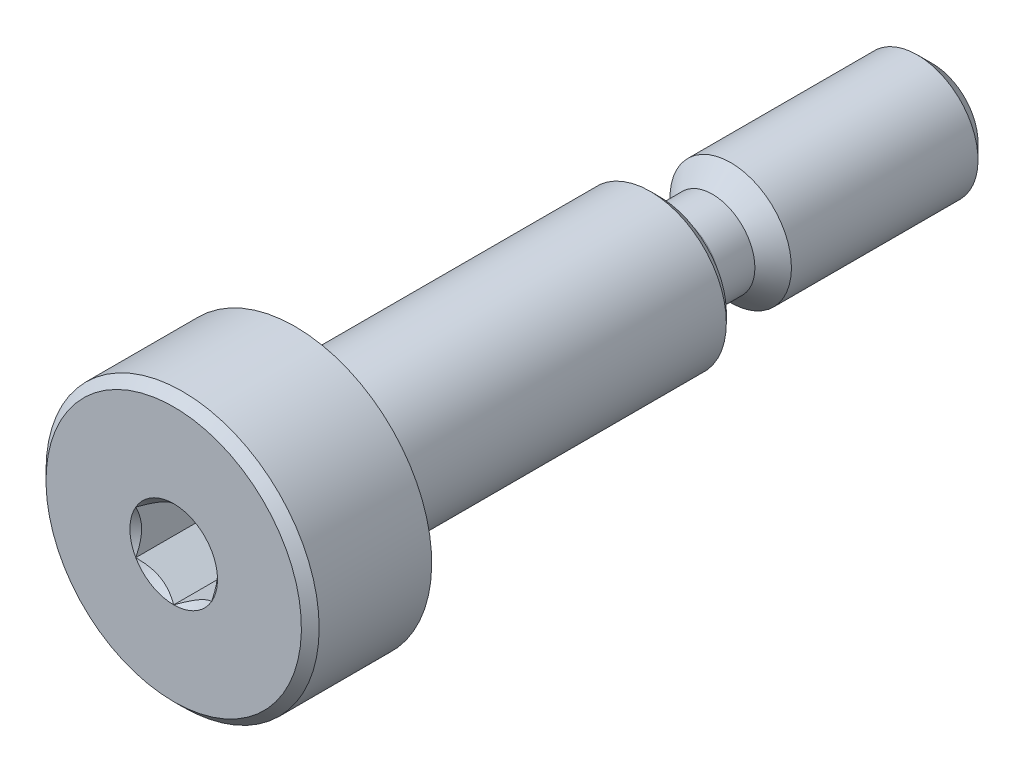
from build123d import *

# Parameters (mm, degrees)
SKETCH12_W         = 0.6
SKETCH12_H         = 0.6
CHAMFER3_SIZE      = 0.1625
CHAMFER1_SIZE      = 0.5
CHAMFER2_SIZE      = 0.2925
CUT_EXTRUDE2_DEPTH = 2


with BuildPart() as part:
    # Sketch1 → Revolve1 (revolve)
    with BuildSketch(Plane(origin=(0, 0, 0), x_dir=(0, 0, -1), z_dir=(1, 0, 0))):
        Polygon((0, 4.5), (4, 4.5), (4, 2.5), (16, 2.5), (16, 2), (25, 2), (25, 0), (0, 0), align=None)
    revolve(axis=Axis((0, 0, -25), (0, 0, 1)))

    # Sketch12 → Cut-Revolve2 (revolve, cut)
    with BuildSketch(Plane(origin=(0, 0, 0), x_dir=(0, 0, -1), z_dir=(1, 0, 0))):
        with Locations((4.3, 2.2)):
            Rectangle(SKETCH12_W, SKETCH12_H)
    revolve(axis=Axis((0, 0, -25), (0, 0, 1)), mode=Mode.SUBTRACT)

    # Chamfer3
    chamfer3_edges = [part.edges().sort_by_distance(p)[0] for p in [
        (0, -2.5, -4.6),
        (0, -1.9, -4.6),
    ]]
    chamfer(chamfer3_edges, length=CHAMFER3_SIZE)

    # Sketch5 → Cut-Revolve1 (revolve, cut)
    with BuildSketch(Plane(origin=(0, 0, 0), x_dir=(0, 0, -1), z_dir=(1, 0, 0))):
        with BuildLine():
            Line((16, 2.5), (18.852, 2.5))
            Line((18.852, 2.5), (17.75, 1.398))
            Line((17.75, 1.398), (16.602, 1.398))
            ThreePointArc((16.602, 1.398), (16.176321718, 1.574321718), (16, 2))
            Line((16, 2), (16, 2.5))
        make_face()
    revolve(axis=Axis((0, 0, -25), (0, 0, 1)), mode=Mode.SUBTRACT)

    # Chamfer1
    chamfer1_edges = [part.edges().sort_by_distance(p)[0] for p in [
        (0, -2, -25),
    ]]
    chamfer(chamfer1_edges, length=CHAMFER1_SIZE)

    # Chamfer2
    chamfer2_edges = [part.edges().sort_by_distance(p)[0] for p in [
        (0, -4.5, 0),
        (0, -2.5, -16),
    ]]
    chamfer(chamfer2_edges, length=CHAMFER2_SIZE)

    # Sketch8 → Cut-Extrude2 (cut)
    with BuildSketch(Plane.XY):
        Polygon((1.25, 0.721687836), (0, 1.443375673), (-1.25, 0.721687836), (-1.25, -0.721687836), (0, -1.443375673), (1.25, -0.721687836), align=None)
    extrude(amount=-CUT_EXTRUDE2_DEPTH, mode=Mode.SUBTRACT)

    # Cut-Extrude4 cone 1 section (through the dimple's axis) → Cut-Extrude4 (revolve, cut)
    with BuildSketch(Plane(origin=(0, 0, 0), x_dir=(0, -1, 0), z_dir=(1, 0, 0))):
        Polygon((0, 0), (1.443375673, 0), (0, 1.443375673), align=None)
    revolve(axis=Axis((0, 0, 0), (0, 0, -1)), mode=Mode.SUBTRACT)


solid = part.part
